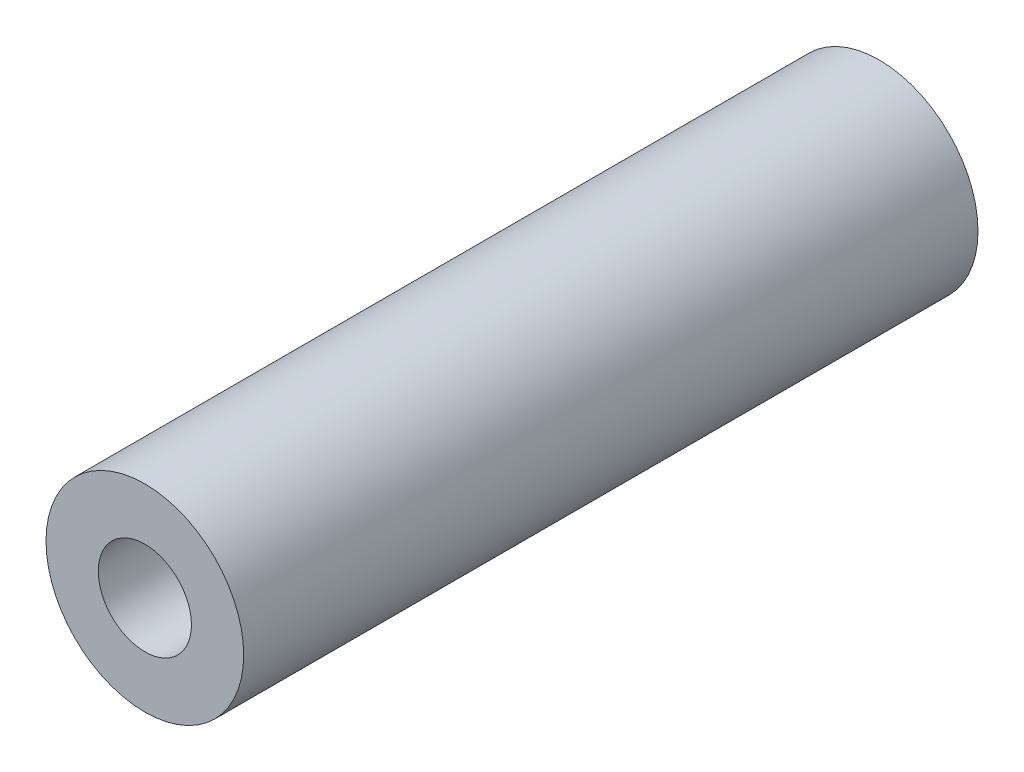
from build123d import *

# Parameters (mm, degrees)
S01_ANNULAR_SECTION_R      = 7
S01_ANNULAR_SECTION_R_2    = 3.3
F_01_ANNULAR_SECTION_DEPTH = 52


with BuildPart() as part:
    # S01 - Annular section → 01 - Annular section (new body)
    with BuildSketch(Plane.XY):
        Circle(S01_ANNULAR_SECTION_R)
        Circle(S01_ANNULAR_SECTION_R_2, mode=Mode.SUBTRACT)
    extrude(amount=F_01_ANNULAR_SECTION_DEPTH)


solid = part.part
